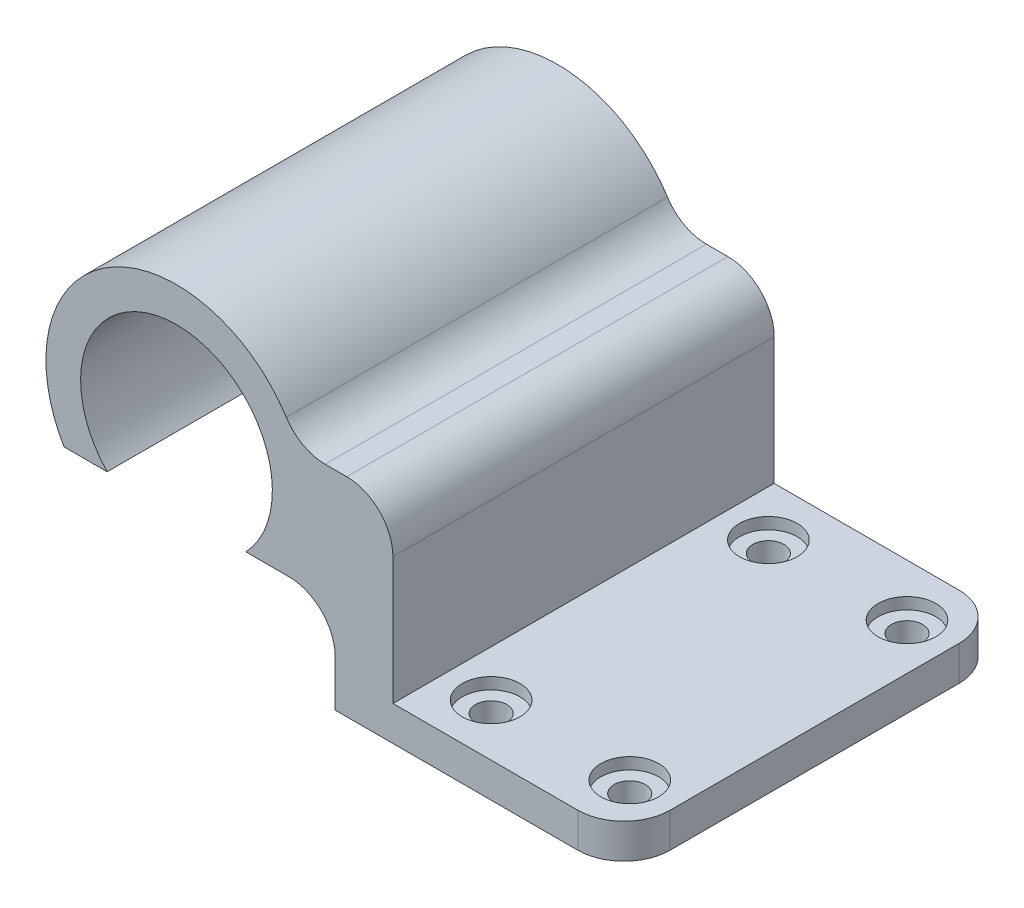
from build123d import *

# Parameters (mm, degrees)
BOSS_EXTRUDE1_DEPTH = 33
BOSS_EXTRUDE2_DEPTH = 33
FILLET1_R           = 4
FILLET3_R           = 4
SKETCH3_R           = 1.35
CUT_EXTRUDE1_DEPTH  = 10
SKETCH4_R           = 2.5
CUT_EXTRUDE2_DEPTH  = 1
FILLET4_R           = 4


with BuildPart() as part:
    # Sketch1 → Boss-Extrude1 (new body)
    with BuildSketch(Plane.XY):
        with BuildLine():
            Line((-9.736529156, -5.734980384), (-6, -5.734980384))
            ThreePointArc((-6, -5.734980384), (0, 8.3), (6, -5.734980384))
            Line((6, -5.734980384), (9.736529156, -5.734980384))
            ThreePointArc((9.736529156, -5.734980384), (0, 11.3), (-9.736529156, -5.734980384))
        make_face()
    extrude(amount=BOSS_EXTRUDE1_DEPTH)

    # Sketch2 → Boss-Extrude2 (add)
    with BuildSketch(Plane(origin=(0, 0, 0), x_dir=(-1, 0, 0), z_dir=(0, 0, -1))):
        with BuildLine():
            Line((-10.464206022, 4.265019616), (-18.736529156, 4.265019616))
            Line((-18.736529156, 4.265019616), (-18.736529156, -10.734980384))
            Line((-18.736529156, -10.734980384), (-38.736529156, -10.734980384))
            Line((-38.736529156, -10.734980384), (-38.736529156, -13.734980384))
            Line((-38.736529156, -13.734980384), (-13.736529156, -13.734980384))
            Line((-13.736529156, -13.734980384), (-13.736529156, -5.734980384))
            Line((-13.736529156, -5.734980384), (-9.736529156, -5.734980384))
            ThreePointArc((-9.736529156, -5.734980384), (-11.270200772, -0.820106438), (-10.464206022, 4.265019616))
        make_face()
    extrude(amount=-BOSS_EXTRUDE2_DEPTH)

    # Fillet1
    fillet1_edges = [part.edges().sort_by_distance(p)[0] for p in [
        (18.736529156, 4.265019616, 16.5),
        (10.464206022, 4.265019616, 16.5),
    ]]
    fillet(fillet1_edges, radius=FILLET1_R)

    # Fillet3
    fillet3_edges = [part.edges().sort_by_distance(p)[0] for p in [
        (13.736529156, -5.734980384, 16.5),
    ]]
    fillet(fillet3_edges, radius=FILLET3_R)

    # Sketch3 → Cut-Extrude1 (cut)
    with BuildSketch(Plane(origin=(0, -10.734980384, 0), x_dir=(1, 0, 0), z_dir=(0, 1, 0))):
        with Locations(Location((22.736529156, -4.5, 0), (0, 0, 180))):
            Circle(SKETCH3_R)
        with Locations(Location((34.736529156, -4.5, 0), (0, 0, 180))):
            Circle(SKETCH3_R)
        with Locations(Location((34.736529156, -28.5, 0), (0, 0, 180))):
            Circle(SKETCH3_R)
        with Locations(Location((22.736529156, -28.5, 0), (0, 0, 180))):
            Circle(SKETCH3_R)
    extrude(amount=-CUT_EXTRUDE1_DEPTH, mode=Mode.SUBTRACT)

    # Sketch4 → Cut-Extrude2 (cut)
    with BuildSketch(Plane(origin=(0, -10.734980384, 0), x_dir=(1, 0, 0), z_dir=(0, 1, 0))):
        with Locations(Location((22.736529156, -28.5, 0), (0, 0, 180))):
            Circle(SKETCH4_R)
        with Locations(Location((34.736529156, -28.5, 0), (0, 0, 180))):
            Circle(SKETCH4_R)
        with Locations(Location((34.736529156, -4.5, 0), (0, 0, 180))):
            Circle(SKETCH4_R)
        with Locations(Location((22.736529156, -4.5, 0), (0, 0, 180))):
            Circle(SKETCH4_R)
    extrude(amount=-CUT_EXTRUDE2_DEPTH, mode=Mode.SUBTRACT)

    # Fillet4
    fillet4_edges = [part.edges().sort_by_distance(p)[0] for p in [
        (38.736529156, -12.234980384, 0),
        (38.736529156, -12.234980384, 33),
    ]]
    fillet(fillet4_edges, radius=FILLET4_R)


solid = part.part
